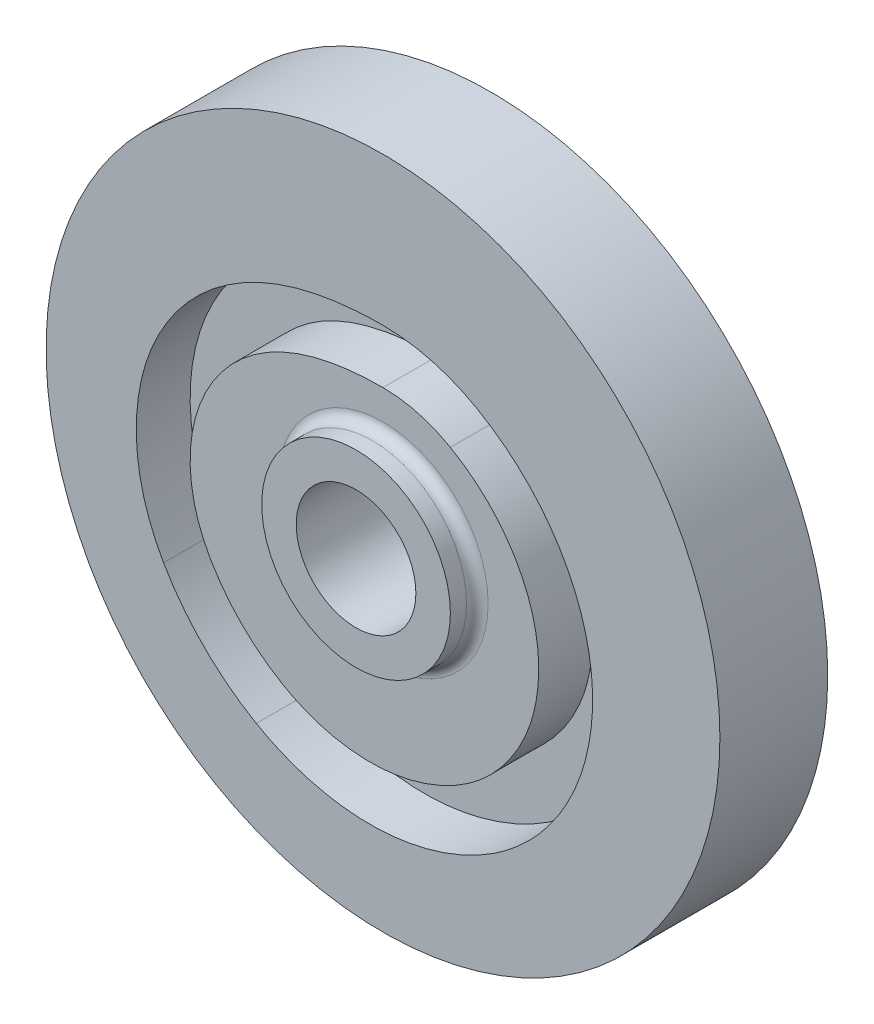
from build123d import *

# Parameters (mm, degrees)
SKETCH_1_R          = 62.5
SKETCH_1_R_2        = 17.5
EXTRUDE_1_DEPTH     = 20
SKETCH_1_3_R        = 17.5
SKETCH_1_3_R_2      = 11.1
EXTRUDE_2_DEPTH     = 25
FILLET_1_R          = 2
CUT_EXTRUDE_3_DEPTH = 10


with BuildPart() as part:
    # 草圖1 → 伸長1 (new body)
    with BuildSketch(Plane.XY):
        Circle(SKETCH_1_R)
        Circle(SKETCH_1_R_2, mode=Mode.SUBTRACT)
    extrude(amount=EXTRUDE_1_DEPTH)

    # 草圖1<3> → 伸長2 (add)
    with BuildSketch(Plane.XY):
        Circle(SKETCH_1_3_R)
        Circle(SKETCH_1_3_R_2, mode=Mode.SUBTRACT)
    extrude(amount=EXTRUDE_2_DEPTH)

    # 圓角1
    fillet_1_edges = [part.edges().sort_by_distance(p)[0] for p in [
        (-17.5, 0, 20),
    ]]
    fillet(fillet_1_edges, radius=FILLET_1_R)

    # 草圖2 → 伸長3 (cut)
    # profile 1 of 2: a face of its own
    with BuildSketch(Plane.XY.offset(20)):
        with BuildLine():
            add(Edge.make_bspline(
                [(-40.703193978, -23.5), (-41.633468538, -21.888717197), (-43.261081238, -18.515622169), (-45.47602304, -11.436735837), (-46.243691745, -2.107968515), (-43.902529687, 8.897505781), (-38.463548338, 18.728740964), (-30.481363737, 26.558580127), (-20.761184619, 31.841785399), (-12.098446566, 34.077729261), (-5.163063209, 34.881869437), (-1.724610104, 35), (0, 35)],
                knots=[0, 0, 0, 0, 0.0625, 0.125, 0.25, 0.375, 0.5, 0.625, 0.75, 0.875, 0.9375, 1, 1, 1, 1], degree=3))
            ThreePointArc((0, 35), (9.058666579, 33.80740392), (17.5, 30.310889132))
            add(Edge.make_bspline(
                [(17.5, 30.310889132), (19.823071752, 28.969663031), (24.242241599, 25.860788384), (31.767486538, 18.159304931), (36.957936485, 8.442419858), (39.023468486, -2.347510431), (38.872672018, -10.560155104), (37.094152942, -18.593345142), (33.679815381, -26.106950798), (28.861351557, -32.744129421), (20.777254706, -40.190094393), (10.741659927, -44.903538266), (-0.034110412, -46.584563974), (-8.185130119, -46.241615161), (-14.797664919, -44.661390317), (-19.864008497, -42.647893398), (-22.312751805, -41.388652043), (-23.5, -40.703193978)],
                knots=[0, 0, 0, 0, 0.0625, 0.125, 0.25, 0.3125, 0.375, 0.4375, 0.5, 0.5625, 0.625, 0.75, 0.8125, 0.875, 0.9375, 0.96875, 1, 1, 1, 1], degree=3))
            ThreePointArc((-23.5, -40.703193978), (-33.234018716, -33.234018716), (-40.703193978, -23.5))
        make_face()
        with BuildLine():
            ThreePointArc((-36.373066959, -21), (-29.69848481, -29.69848481), (-21, -36.373066959))
            add(Edge.make_bspline(
                [(15, 25.980762114), (19.626342308, 23.309742136), (27.962941081, 15.94725242), (35.002577573, -0.237057072), (33.123865827, -19.358084353), (20.586920622, -35.934246999), (-0.118084402, -43.440012631), (-14.591726515, -40.07288538), (-21, -36.373066959)],
                knots=[0, 0, 0, 0, 0.139447987, 0.287926298, 0.449747773, 0.62466703, 0.809633221, 1, 1, 1, 1], degree=3))
            ThreePointArc((15, 25.980762114), (7.764571353, 28.977774789), (0, 30))
            add(Edge.make_bspline(
                [(-36.373066959, -21), (-38.826726203, -16.750137525), (-41.728361124, -7.389186422), (-39.760869449, 6.972263731), (-32.441668175, 18.614971808), (-22.070852951, 26.028055814), (-10.910814995, 29.43602294), (-3.551275269, 30), (0, 30)],
                knots=[0, 0, 0, 0, 0.188917464, 0.373337047, 0.548988681, 0.712236233, 0.861396552, 1, 1, 1, 1], degree=3))
        make_face(mode=Mode.SUBTRACT)
    # profile 2 of 2: a face of its own
    with BuildSketch(Plane.XY.offset(20)):
        with BuildLine():
            add(Edge.make_bspline(
                [(-36.373066959, -21), (-38.826726203, -16.750137525), (-41.728361124, -7.389186422), (-39.760869449, 6.972263731), (-32.441668175, 18.614971808), (-22.070852951, 26.028055814), (-10.910814995, 29.43602294), (-3.551275269, 30), (0, 30)],
                knots=[0, 0, 0, 0, 0.188917464, 0.373337047, 0.548988681, 0.712236233, 0.861396552, 1, 1, 1, 1], degree=3))
            ThreePointArc((0, 30), (7.764571353, 28.977774789), (15, 25.980762114))
            add(Edge.make_bspline(
                [(15, 25.980762114), (19.626342308, 23.309742136), (27.962941081, 15.94725242), (35.002577573, -0.237057072), (33.123865827, -19.358084353), (20.586920622, -35.934246999), (-0.118084402, -43.440012631), (-14.591726515, -40.07288538), (-21, -36.373066959)],
                knots=[0, 0, 0, 0, 0.139447987, 0.287926298, 0.449747773, 0.62466703, 0.809633221, 1, 1, 1, 1], degree=3))
            ThreePointArc((-21, -36.373066959), (-29.69848481, -29.69848481), (-36.373066959, -21))
        make_face()
        with BuildLine():
            ThreePointArc((-32.04293994, -18.5), (-26.162950904, -26.162950904), (-18.5, -32.04293994))
            add(Edge.make_bspline(
                [(12.5, 21.650635095), (14.30005051, 20.611375448), (17.736546036, 18.19228211), (22.05735975, 13.766251439), (25.469897133, 8.589069076), (27.834895803, 2.837183943), (28.986233619, -3.184904344), (28.876055873, -9.377887783), (27.535742309, -15.415921648), (24.990235447, -21.021768672), (21.332338771, -26.062630488), (16.775819727, -30.259430929), (11.450819301, -33.450705308), (5.550233068, -35.577660612), (-0.603962424, -36.53664799), (-6.792105874, -36.274910535), (-12.848540176, -34.833293242), (-16.692189533, -33.0866798), (-18.5, -32.04293994)],
                knots=[0, 0, 0, 0, 0.0625, 0.125, 0.1875, 0.25, 0.3125, 0.375, 0.4375, 0.5, 0.5625, 0.625, 0.6875, 0.75, 0.8125, 0.875, 0.9375, 1, 1, 1, 1], degree=3))
            ThreePointArc((12.5, 21.650635095), (6.470476128, 24.148145657), (0, 25))
            add(Edge.make_bspline(
                [(-32.04293994, -18.5), (-32.728164967, -17.313155438), (-33.927114764, -14.828407043), (-35.558015667, -9.615244062), (-36.119608205, -2.766575398), (-34.400322061, 5.348624633), (-30.388137801, 12.591820816), (-25.469517856, 17.423005266), (-20.794111606, 20.416968225), (-15.767671789, 22.768018014), (-10.206799727, 24.225660689), (-4.442252157, 24.897281873), (-1.474613785, 25), (0, 25)],
                knots=[0, 0, 0, 0, 0.0625, 0.125, 0.25, 0.375, 0.5, 0.625, 0.6875, 0.75, 0.875, 0.9375, 1, 1, 1, 1], degree=3))
        make_face(mode=Mode.SUBTRACT)
    extrude(amount=-CUT_EXTRUDE_3_DEPTH, mode=Mode.SUBTRACT)


solid = part.part
